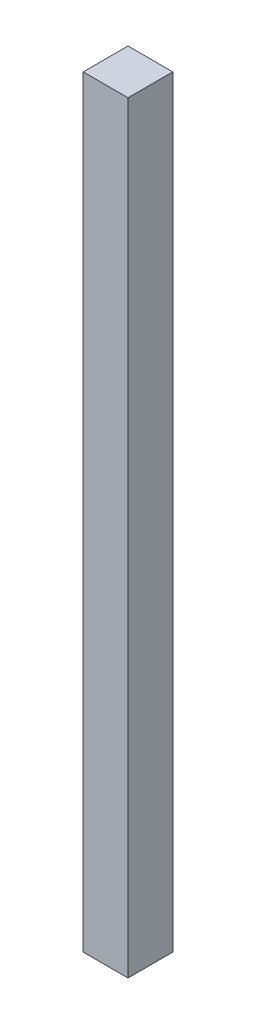
from build123d import *

# Parameters (mm, degrees)
ESBO_O1_W                = 100
ESBO_O1_H                = 100
RESSALTO_EXTRUS_O1_DEPTH = 1700


with BuildPart() as part:
    # Esboço1 → Ressalto-extrusão1 (new body)
    with BuildSketch(Plane(origin=(0, 0, 0), x_dir=(1, 0, 0), z_dir=(0, 1, 0))):
        Rectangle(ESBO_O1_W, ESBO_O1_H)
    extrude(amount=RESSALTO_EXTRUS_O1_DEPTH)


solid = part.part
